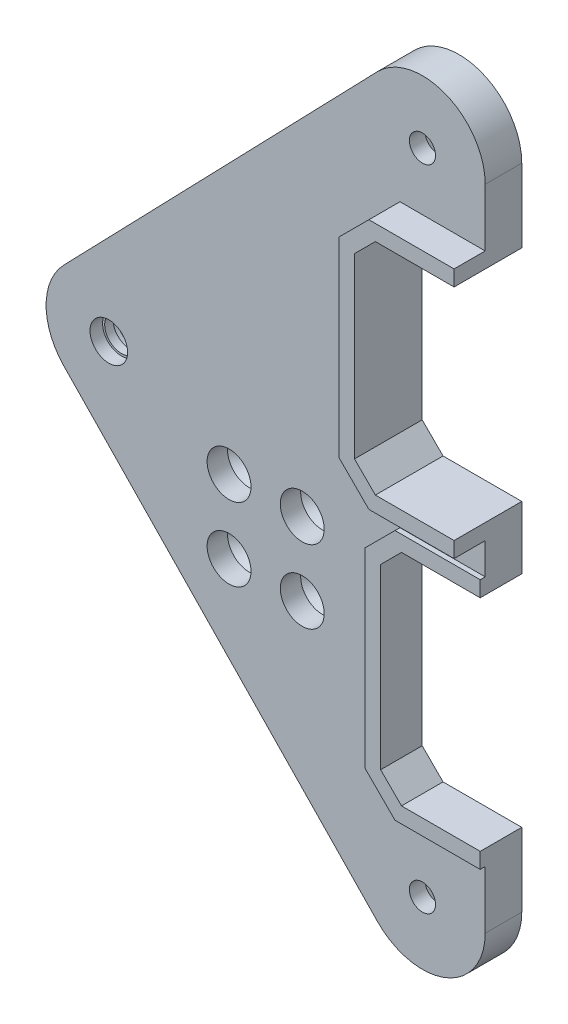
from build123d import *

# Parameters (mm, degrees)
BOSS_EXTRUDE1_DEPTH            = 7
BOSS_EXTRUDE2_DEPTH            = 5.95
BOSS_EXTRUDE3_DEPTH            = 0.95
CUT_EXTRUDE1_DEPTH             = 105.091810437
CUT_EXTRUDE2_START             = -2.4
SKETCH5_R                      = 3.6
CUT_EXTRUDE2_DEPTH             = 2.4
CBORE_FOR_M5_SHCS1_D           = 6.4
CBORE_FOR_M5_SHCS1_CBORE_D     = 12.8
CBORE_FOR_M5_SHCS1_CBORE_DEPTH = 3
CUT_EXTRUDE3_DEPTH             = 4
F_5_0_5_DIAMETER_HOLE1_D       = 5
CSK_FOR_M4_SFHCS1_AT_2_COUNT   = 2
CSK_FOR_M4_SFHCS1_AT_2_PITCH   = 14
CSK_FOR_M4_SFHCS1_AT_3_COUNT   = 2
CSK_FOR_M4_SFHCS1_AT_3_PITCH   = 19.798989873
CSK_FOR_M4_SFHCS1_AT_4_COUNT   = 2
CSK_FOR_M4_SFHCS1_AT_4_PITCH   = 14


with BuildPart() as part:
    # Sketch1 → Boss-Extrude1 (new body)
    with BuildSketch(Plane.XY):
        with BuildLine():
            Line((-8.626586736, 70.391582661), (-68.626586736, 8.341582661))
            ThreePointArc((-68.626586736, 8.341582661), (-72, 0), (-68.626586736, -8.341582661))
            Line((-68.626586736, -8.341582661), (-8.626586736, -70.391582661))
            ThreePointArc((-8.626586736, -70.391582661), (4.498942052, -73.174725633), (12, -62.05))
            Line((12, -62.05), (12, 62.05))
            ThreePointArc((12, 62.05), (4.498942052, 73.174725633), (-8.626586736, 70.391582661))
        make_face()
    extrude(amount=BOSS_EXTRUDE1_DEPTH)

    # Sketch3 → Boss-Extrude2 (add)
    with BuildSketch(Plane(origin=(0, 0, 7), x_dir=(-1, 0, 0), z_dir=(0, 0, -1))):
        Polygon((-12, 3), (-12, 51), (4.299630176, 51), (10.05, 45.249630176), (10.05, 8.750369824), (4.299630176, 3), align=None)
    extrude(amount=-BOSS_EXTRUDE2_DEPTH)

    # Sketch4 → Boss-Extrude3 (add)
    with BuildSketch(Plane.XY.offset(7)):
        Polygon((12, -51), (12, -3), (-4.299630176, -3), (-10.05, -8.750369824), (-10.05, -45.249630176), (-4.299630176, -51), align=None)
    extrude(amount=BOSS_EXTRUDE3_DEPTH)

    # Sketch2 → Cut-Extrude1 (cut, through all)
    with BuildSketch(Plane(origin=(0, 0, 0), x_dir=(-1, 0, 0), z_dir=(0, 0, -1))):
        Polygon((-34.95, 48), (3.056989489, 48), (7.05, 44.006989489), (7.05, 9.993010511), (3.056989489, 6), (-30.956989489, 6), (-30.956989489, -6), (3.056989489, -6), (7.05, -9.993010511), (7.05, -44.006989489), (3.056989489, -48), (-34.95, -48), align=None)
    extrude(amount=-CUT_EXTRUDE1_DEPTH, mode=Mode.SUBTRACT)

    # Sketch5 → Cut-Extrude2 (cut)
    with BuildSketch(Plane.XY.offset(7).offset(CUT_EXTRUDE2_START)):
        with Locations((-60, 0)):
            Circle(SKETCH5_R)
    extrude(amount=CUT_EXTRUDE2_DEPTH, mode=Mode.SUBTRACT)

    # CBORE for M5 SHCS1 (through all)
    with Locations(Plane(origin=(0, 0, 0), x_dir=(-1, 0, 0), z_dir=(0, 0, -1))):
        with Locations((60, 0)):
            CounterBoreHole(CBORE_FOR_M5_SHCS1_D / 2, CBORE_FOR_M5_SHCS1_CBORE_D / 2, CBORE_FOR_M5_SHCS1_CBORE_DEPTH)

    # Sketch8 → Cut-Extrude3 (cut)
    with BuildSketch(Plane(origin=(0, 0, 0), x_dir=(-1, 0, 0), z_dir=(0, 0, -1))):
        Polygon((-2.309401077, 58.05), (2.309401077, 58.05), (4.618802154, 62.05), (2.309401077, 66.05), (-2.309401077, 66.05), (-4.618802154, 62.05), align=None)
    cut_extrude3 = extrude(amount=-CUT_EXTRUDE3_DEPTH, mode=Mode.SUBTRACT)

    # Ø5.0 (5) Diameter Hole1 (through all)
    with Locations(Plane(origin=(0, 0, 4), x_dir=(-1, 0, 0), z_dir=(0, 0, -1))):
        with Locations((0, 62.05)):
            f_5_0_5_diameter_hole1 = Hole(F_5_0_5_DIAMETER_HOLE1_D / 2)

    # Mirror1: Cut-Extrude3, Ø5.0 (5) Diameter Hole1 across plane
    add(cut_extrude3.mirror(Plane.ZX), mode=Mode.SUBTRACT)
    add(f_5_0_5_diameter_hole1.mirror(Plane.ZX), mode=Mode.SUBTRACT)

    # Sketch12 → CSK for M4 SFHCS1 (revolve, cut)
    with BuildSketch(Plane(origin=(-37, -24.5, 7), x_dir=(0, -1, 0), z_dir=(1, 0, 0))):
        Polygon((0, 0), (0, 7), (2.1, 7), (2.1, 6), (4.2, 3.9), (4.2, 0), align=None)
    csk_for_m4_sfhcs1 = revolve(axis=Axis((-37, -24.5, 13.35), (0, 0, -1)), mode=Mode.SUBTRACT)

    # CSK for M4 SFHCS1 at 2: CSK for M4 SFHCS1 ×2
    with Locations(*[(i * CSK_FOR_M4_SFHCS1_AT_2_PITCH, 0, 0) for i in range(1, CSK_FOR_M4_SFHCS1_AT_2_COUNT)]):
        add(csk_for_m4_sfhcs1, mode=Mode.SUBTRACT)

    # CSK for M4 SFHCS1 at 3: CSK for M4 SFHCS1 ×2
    with Locations(*[Vector(0.7071067811865477, 0.7071067811865474, 0) * (i * CSK_FOR_M4_SFHCS1_AT_3_PITCH) for i in range(1, CSK_FOR_M4_SFHCS1_AT_3_COUNT)]):
        add(csk_for_m4_sfhcs1, mode=Mode.SUBTRACT)

    # CSK for M4 SFHCS1 at 4: CSK for M4 SFHCS1 ×2
    with Locations(*[(0, i * CSK_FOR_M4_SFHCS1_AT_4_PITCH, 0) for i in range(1, CSK_FOR_M4_SFHCS1_AT_4_COUNT)]):
        add(csk_for_m4_sfhcs1, mode=Mode.SUBTRACT)


solid = part.part
